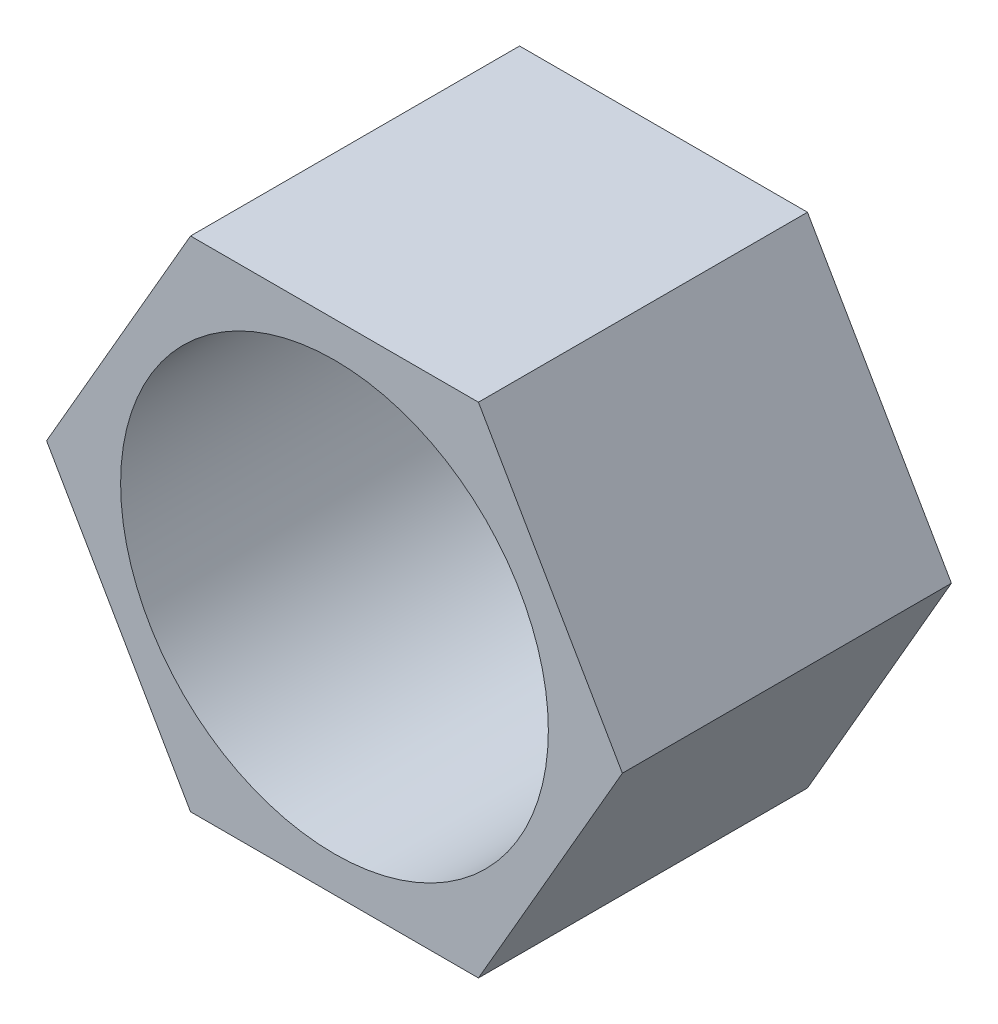
from build123d import *

# Parameters (mm, degrees)
BOSS_EXTRUDE1_DEPTH = 0.1
SKETCH2_R           = 0.13
CUT_EXTRUDE1_DEPTH  = 0.2


with BuildPart() as part:
    # Sketch1 → Boss-Extrude1 (new, symmetric)
    with BuildSketch(Plane.XY):
        Polygon((0.175, 0), (0.0875, 0.151554446), (-0.0875, 0.151554446), (-0.175, 0), (-0.0875, -0.151554446), (0.0875, -0.151554446), align=None)
    extrude(amount=BOSS_EXTRUDE1_DEPTH, both=True)

    # Sketch2 → Cut-Extrude1 (cut)
    with BuildSketch(Plane.XY.offset(0.1)):
        Circle(SKETCH2_R)
    extrude(amount=-CUT_EXTRUDE1_DEPTH, mode=Mode.SUBTRACT)


solid = part.part
